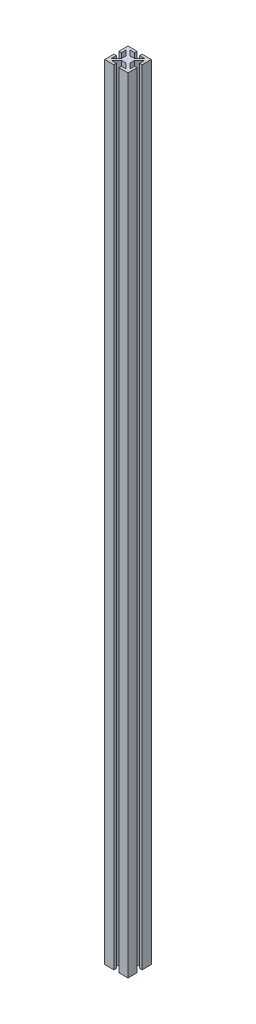
from build123d import *

# Parameters (mm, degrees)
BOSS_EXTRUDE1_DEPTH = 1282.7


with BuildPart() as part:
    # Sketch2 → Boss-Extrude1 (new body)
    with BuildSketch(Plane(origin=(0.594697292, 0, 0.594697292), x_dir=(1, 0, 0), z_dir=(0, 1, 0))):
        Polygon((-19.644697292, 19.644697292), (-4.658697292, 19.644697292), (-4.658697292, 15.580697292), (-12.707015333, 15.580697292), (-4.477415333, 7.351097292), (3.288020749, 7.351097292), (11.517620749, 15.580697292), (3.469302708, 15.580697292), (3.469302708, 19.644697292), (18.455302708, 19.644697292), (18.455302708, 4.658697292), (14.391302708, 4.658697292), (14.391302708, 12.707015333), (6.161702708, 4.477415333), (6.161702708, -3.288020749), (14.391302708, -11.517620749), (14.391302708, -3.469302708), (18.455302708, -3.469302708), (18.455302708, -18.455302708), (3.469302708, -18.455302708), (3.469302708, -14.391302708), (11.517620749, -14.391302708), (3.288020749, -6.161702708), (-4.477415333, -6.161702708), (-12.707015333, -14.391302708), (-4.658697292, -14.391302708), (-4.658697292, -18.455302708), (-19.644697292, -18.455302708), (-19.644697292, -3.469302708), (-15.580697292, -3.469302708), (-15.580697292, -11.517620749), (-7.351097292, -3.288020749), (-7.351097292, 4.477415333), (-15.580697292, 12.707015333), (-15.580697292, 4.658697292), (-19.644697292, 4.658697292), align=None)
    extrude(amount=BOSS_EXTRUDE1_DEPTH)


solid = part.part
